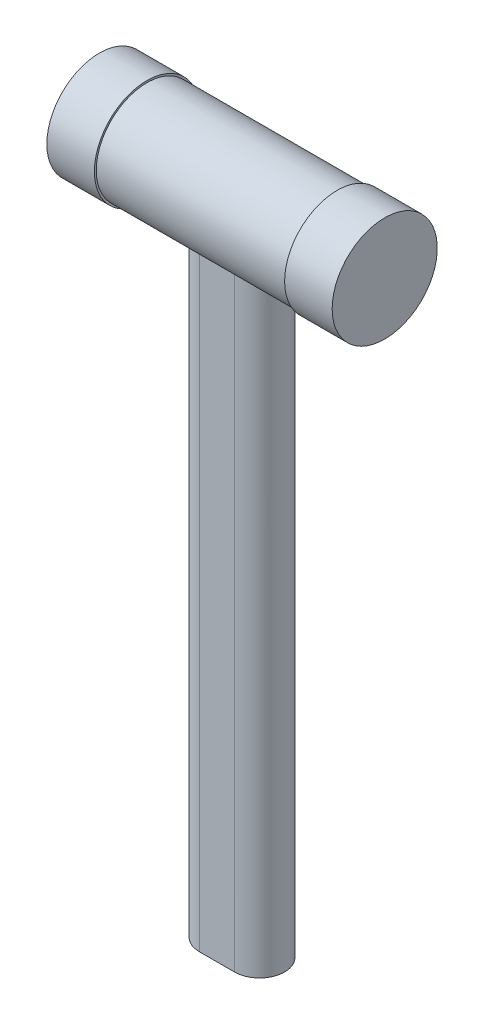
from build123d import *

# Parameters (mm, degrees)
SKIZZE1_W                       = 76
SKIZZE1_H                       = 20.25
AUFSATZ_LINEAR_AUSTRAGEN1_DEPTH = 260


with BuildPart() as part:
    # Skizze1 → Rotation1 (revolve)
    with BuildSketch(Plane.XY, mode=Mode.PRIVATE) as rotation1_sk:
        with Locations((0, 10.125)):
            Rectangle(SKIZZE1_W, SKIZZE1_H)
        Polygon((-57, 21), (-57, 0), (-38, 0), (-38, 20.25), (-38, 21), align=None)
        Polygon((38, 20.25), (38, 0), (57, 0), (57, 21), (38, 21), align=None)
    revolve(rotation1_sk.sketch.rotate(Axis((-67.247528095, 0, 0), (1, 0, 0)), 90), axis=Axis((-67.247528095, 0, 0), (1, 0, 0)))

    # Skizze2 → Aufsatz-Linear austragen1 (add)
    with BuildSketch(Plane(origin=(0, 0, 0), x_dir=(1, 0, 0), z_dir=(0, 1, 0))):
        with BuildLine():
            Line((-7, 10), (7, 10))
            ThreePointArc((7, 10), (17, 0), (7, -10))
            Line((7, -10), (-7, -10))
            ThreePointArc((-7, -10), (-17, 0), (-7, 10))
        make_face()
    extrude(amount=-AUFSATZ_LINEAR_AUSTRAGEN1_DEPTH)


solid = part.part
